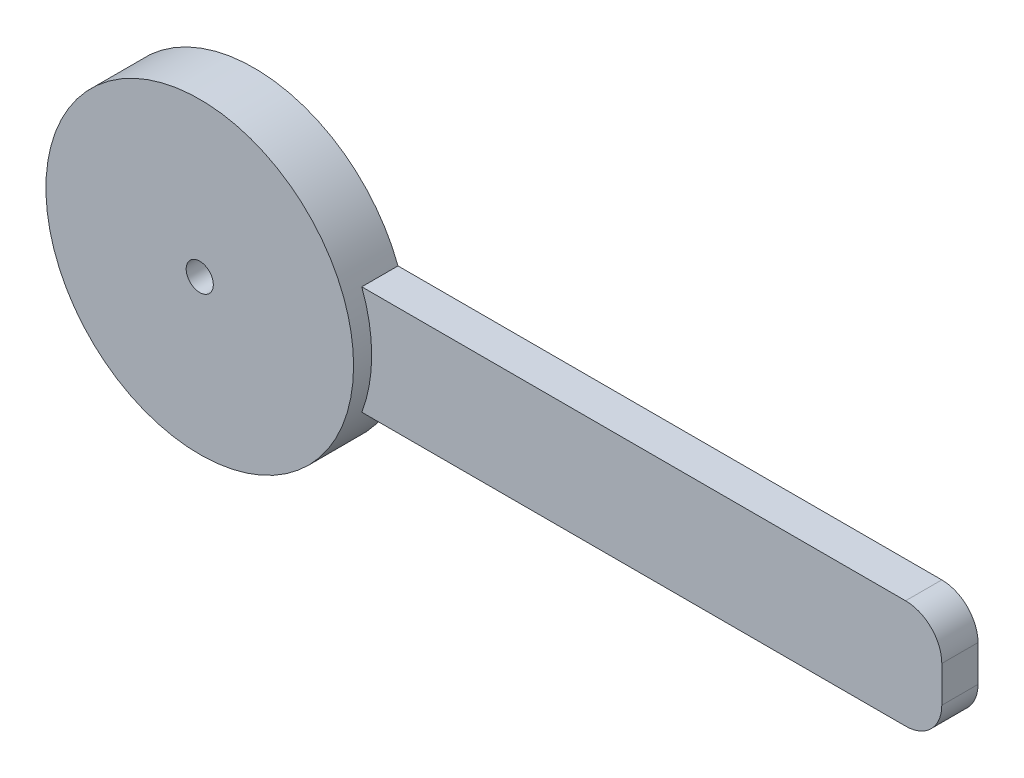
from build123d import *
from build123d.topology import SkipClean

# Parameters (mm, degrees)
SKETCH1_W                       = 80
SKETCH1_H                       = 12
BOSS_EXTRUDE1_DEPTH             = 2
CUT_REVOLVE1_ANGLE              = 180
FILLET2_R                       = 4
BOSS_EXTRUDE2_REACH             = 42.645
SKETCH6_R                       = 17
BOSS_EXTRUDE2_DIRECTION_2_DEPTH = 2
SKETCH7_R                       = 2.5
CUT_EXTRUDE3_DEPTH              = 3
CIRPATTERN1_COUNT               = 6
FILLET3_R                       = 1
CUT_EXTRUDE4_REACH              = 61.783
SKETCH8_R                       = 1.5


with BuildPart() as part:
    # Sketch1 → Boss-Extrude1 (new, symmetric)
    with BuildSketch(Plane.XY):
        Rectangle(SKETCH1_W, SKETCH1_H)
    extrude(amount=BOSS_EXTRUDE1_DEPTH, both=True)

    # Sketch3 → Cut-Revolve1 (revolve, cut)
    with SkipClean():  # the faces are left unmerged after this step: merging them gives an invalid solid
        with BuildSketch(Plane.XY.offset(-2)):
            with BuildLine():
                ThreePointArc((37.75, 0), (35, 2.75), (32.25, 0))
                Line((32.25, 0), (37.75, 0))
            make_face()
            with BuildLine():
                Line((37.75, 0), (32.25, 0))
                ThreePointArc((32.25, 0), (35, -2.75), (37.75, 0))
            make_face()
        revolve(axis=Axis((32.25, 0, -2), (1, 0, 0)), revolution_arc=CUT_REVOLVE1_ANGLE, mode=Mode.SUBTRACT)

    # Fillet2
    fillet2_edges = [part.edges().sort_by_distance(p)[0] for p in [
        (40, -6, 0),
        (40, 6, 0),
    ]]
    fillet(fillet2_edges, radius=FILLET2_R)

    # Boss-Extrude2: up to this face of the body (flat: up to its plane)
    boss_extrude2_end = Plane(part.part.faces().sort_by_distance((-1.183693998, 0, -2))[0])
    # Sketch6 → Boss-Extrude2 (add, up to the picked face)
    with BuildSketch(Plane.XY.offset(2), mode=Mode.PRIVATE) as boss_extrude2_sk1:
        with Locations(Location((-40, 0, 0), (0, 0, 20.667316494))):
            Circle(SKETCH6_R)
    boss_extrude2_tool1 = split(extrude(boss_extrude2_sk1.sketch, amount=-BOSS_EXTRUDE2_REACH, mode=Mode.PRIVATE), bisect_by=boss_extrude2_end, keep=Keep.BOTH, mode=Mode.PRIVATE)
    add(boss_extrude2_tool1.solids().sort_by(Axis((-40, 0, 2), (0, 0, -1)))[0])

    # Sketch6 → Boss-Extrude2 direction 2 (add)
    with BuildSketch(Plane.XY.offset(2)):
        with Locations(Location((-40, 0, 0), (0, 0, 20.667316494))):
            Circle(SKETCH6_R)
    extrude(amount=BOSS_EXTRUDE2_DIRECTION_2_DEPTH)

    # Sketch7 → Cut-Extrude3 (cut)
    with BuildSketch(Plane(origin=(0, 0, -2), x_dir=(-1, 0, 0), z_dir=(0, 0, -1))):
        with BuildLine():
            Line((41.148365434, 4.169758006), (40, 4.325))
            ThreePointArc((40, 4.325), (35.675, 0), (40, -4.325))
            Line((40, -4.325), (41.148365434, -4.169758006))
            ThreePointArc((41.148365434, -4.169758006), (43.440371019, -2.620967808), (44.325, 0))
            ThreePointArc((44.325, 0), (43.440371019, 2.620967808), (41.148365434, 4.169758006))
        make_face()
        with BuildLine():
            Line((53.5, 2.5), (41.148365434, 4.169758006))
            ThreePointArc((41.148365434, 4.169758006), (43.440371019, 2.620967808), (44.325, 0))
            ThreePointArc((44.325, 0), (43.440371019, -2.620967808), (41.148365434, -4.169758006))
            Line((41.148365434, -4.169758006), (53.5, -2.5))
            ThreePointArc((53.5, -2.5), (51, 0), (53.5, 2.5))
        make_face()
        with Locations((53.5, 0)):
            Circle(SKETCH7_R)
    cut_extrude3 = extrude(amount=-CUT_EXTRUDE3_DEPTH, mode=Mode.SUBTRACT)

    # CirPattern1: Cut-Extrude3 ×6 about axis
    cirpattern1_axis = Axis((-40, 0, 0), (0, 0, 1))
    for i in range(1, CIRPATTERN1_COUNT):
        add(cut_extrude3.rotate(cirpattern1_axis, i * 360 / CIRPATTERN1_COUNT), mode=Mode.SUBTRACT)

    # Fillet3
    fillet3_edges = [part.edges().sort_by_distance(p)[0] for p in [
        (-46.069873399, 3.504443041, -0.5),
        (-40, 7.008886081, -0.5),
        (-33.930126601, 3.504443041, -0.5),
        (-33.930126601, -3.504443041, -0.5),
        (-40, -7.008886081, -0.5),
        (-46.069873399, -3.504443041, -0.5),
    ]]
    fillet(fillet3_edges, radius=FILLET3_R)

    # Sketch8 → Cut-Extrude4 (cut, up to next)
    with BuildSketch(Plane.XY.offset(4), mode=Mode.PRIVATE) as cut_extrude4_sk1:
        with Locations((-40, 0)):
            Circle(SKETCH8_R)
    cut_extrude4_tool1 = extrude(cut_extrude4_sk1.sketch, amount=-CUT_EXTRUDE4_REACH, mode=Mode.PRIVATE) & part.part
    add(cut_extrude4_tool1.solids().sort_by_distance((-40, 0, 4))[0], mode=Mode.SUBTRACT)


solid = part.part
